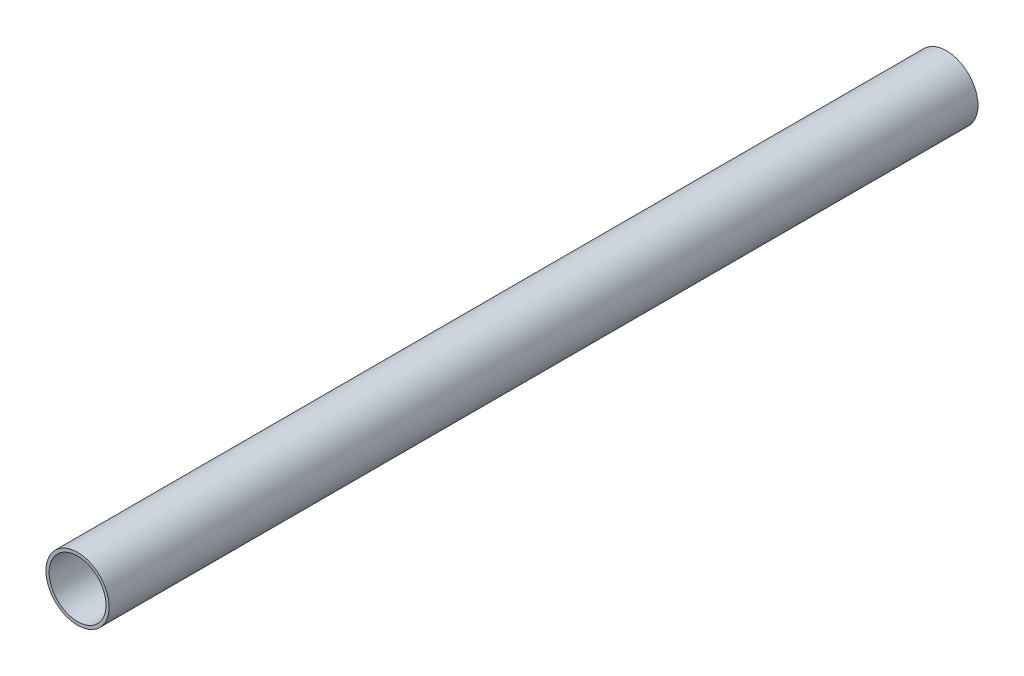
from build123d import *

# Parameters (mm, degrees)
SKETCH1_R           = 8
SKETCH1_R_2         = 7.2
BOSS_EXTRUDE1_DEPTH = 110


with BuildPart() as part:
    # Sketch1 → Boss-Extrude1 (new, symmetric)
    with BuildSketch(Plane.XY):
        Circle(SKETCH1_R)
        Circle(SKETCH1_R_2, mode=Mode.SUBTRACT)
    extrude(amount=BOSS_EXTRUDE1_DEPTH, both=True)


solid = part.part
